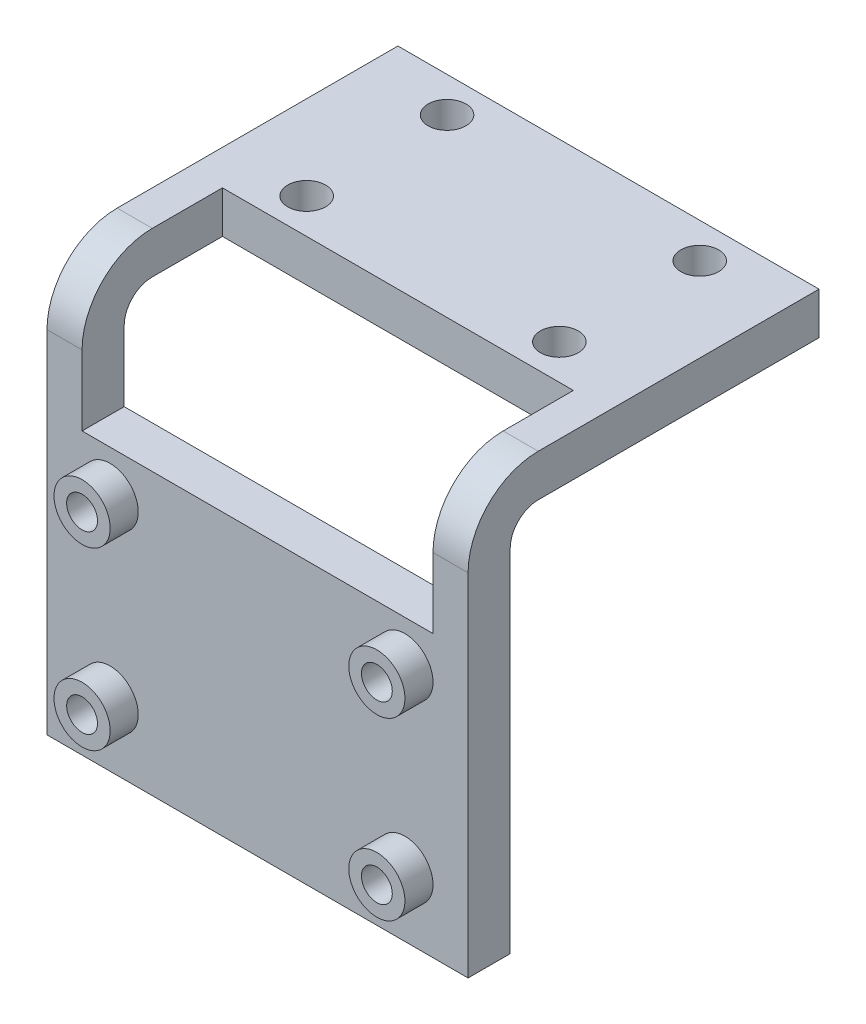
from build123d import *

# Parameters (mm, degrees)
SKETCH2_W           = 30
SKETCH2_H           = 30
BOSS_EXTRUDE1_DEPTH = 3
SKETCH4_R           = 2
BOSS_EXTRUDE2_DEPTH = 2
SKETCH5_R           = 1.1
CUT_EXTRUDE1_DEPTH  = 12
SKETCH6_W           = 25
SKETCH6_H           = 7
CUT_EXTRUDE2_DEPTH  = 3
SKETCH9_W           = 30
SKETCH9_H           = 3
BOSS_EXTRUDE3_DEPTH = 22
SKETCH10_W          = 25
SKETCH10_H          = 3
CUT_EXTRUDE3_DEPTH  = 10
FILLET1_R           = 2
FILLET2_R           = 5
SKETCH11_R          = 1.35
CUT_EXTRUDE4_DEPTH  = 10


with BuildPart() as part:
    # Sketch2 → Boss-Extrude1 (new body)
    with BuildSketch(Plane.XY):
        Rectangle(SKETCH2_W, SKETCH2_H)
    extrude(amount=BOSS_EXTRUDE1_DEPTH)

    # Sketch4 → Boss-Extrude2 (add)
    with BuildSketch(Plane.XY.offset(3)):
        with Locations((-10.5, 2)):
            Circle(SKETCH4_R)
        with Locations((10.5, 2)):
            Circle(SKETCH4_R)
        with Locations((10.5, -10.5)):
            Circle(SKETCH4_R)
        with Locations((-10.5, -10.5)):
            Circle(SKETCH4_R)
    extrude(amount=BOSS_EXTRUDE2_DEPTH)

    # Sketch5 → Cut-Extrude1 (cut)
    with BuildSketch(Plane.XY.offset(5)):
        with Locations((10.5, 2)):
            Circle(SKETCH5_R)
        with Locations((-10.5, 2)):
            Circle(SKETCH5_R)
        with Locations((-10.5, -10.5)):
            Circle(SKETCH5_R)
        with Locations((10.5, -10.5)):
            Circle(SKETCH5_R)
    extrude(amount=-CUT_EXTRUDE1_DEPTH, mode=Mode.SUBTRACT)

    # Sketch6 → Cut-Extrude2 (cut)
    with BuildSketch(Plane.XY.offset(3)):
        with Locations((0, 8.5)):
            Rectangle(SKETCH6_W, SKETCH6_H)
    extrude(amount=-CUT_EXTRUDE2_DEPTH, mode=Mode.SUBTRACT)

    # Sketch9 → Boss-Extrude3 (add)
    with BuildSketch(Plane(origin=(0, 0, 0), x_dir=(-1, 0, 0), z_dir=(0, 0, -1))):
        with Locations((0, 13.5)):
            Rectangle(SKETCH9_W, SKETCH9_H)
    extrude(amount=BOSS_EXTRUDE3_DEPTH)

    # Sketch10 → Cut-Extrude3 (cut)
    with BuildSketch(Plane.XY.offset(3)):
        with Locations((0, 13.5)):
            Rectangle(SKETCH10_W, SKETCH10_H)
    extrude(amount=-CUT_EXTRUDE3_DEPTH, mode=Mode.SUBTRACT)

    # Fillet1
    fillet1_edges = [part.edges().sort_by_distance(p)[0] for p in [
        (-13.75, 12, 0),
        (13.75, 12, 0),
    ]]
    fillet(fillet1_edges, radius=FILLET1_R)

    # Fillet2
    fillet2_edges = [part.edges().sort_by_distance(p)[0] for p in [
        (-13.75, 15, 3),
        (13.75, 15, 3),
    ]]
    fillet(fillet2_edges, radius=FILLET2_R)

    # Sketch11 → Cut-Extrude4 (cut)
    with BuildSketch(Plane(origin=(0, 15, 0), x_dir=(1, 0, 0), z_dir=(0, 1, 0))):
        with Locations(Location((-9, 19.5, 0), (0, 0, 270))):
            Circle(SKETCH11_R)
        with Locations(Location((9, 19.5, 0), (0, 0, 270))):
            Circle(SKETCH11_R)
        with Locations(Location((-9, 9.5, 0), (0, 0, 270))):
            Circle(SKETCH11_R)
        with Locations(Location((9, 9.5, 0), (0, 0, 270))):
            Circle(SKETCH11_R)
    extrude(amount=-CUT_EXTRUDE4_DEPTH, mode=Mode.SUBTRACT)


solid = part.part
